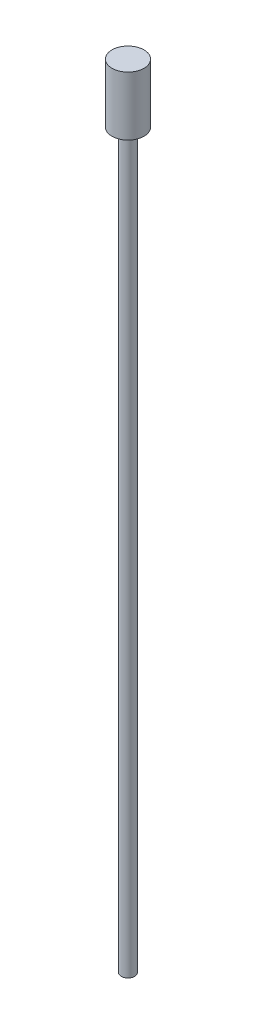
from build123d import *

# Parameters (mm, degrees)
ESQUISSE1_R        = 4
BOSS_EXTRU_1_DEPTH = 435
ESQUISSE2_R        = 9.5
BOSS_EXTRU_2_DEPTH = 35


with BuildPart() as part:
    # Esquisse1 → Boss.-Extru.1 (new body)
    with BuildSketch(Plane(origin=(0, 0, 0), x_dir=(1, 0, 0), z_dir=(0, 1, 0))):
        with Locations(Location((0, 0, 0), (0, 0, 90))):
            Circle(ESQUISSE1_R)
    extrude(amount=BOSS_EXTRU_1_DEPTH)

    # Esquisse2 → Boss.-Extru.2 (add)
    with BuildSketch(Plane(origin=(0, 435, 0), x_dir=(1, 0, 0), z_dir=(0, 1, 0))):
        with Locations(Location((0, 0, 0), (0, 0, 270))):
            Circle(ESQUISSE2_R)
    extrude(amount=BOSS_EXTRU_2_DEPTH)


solid = part.part
